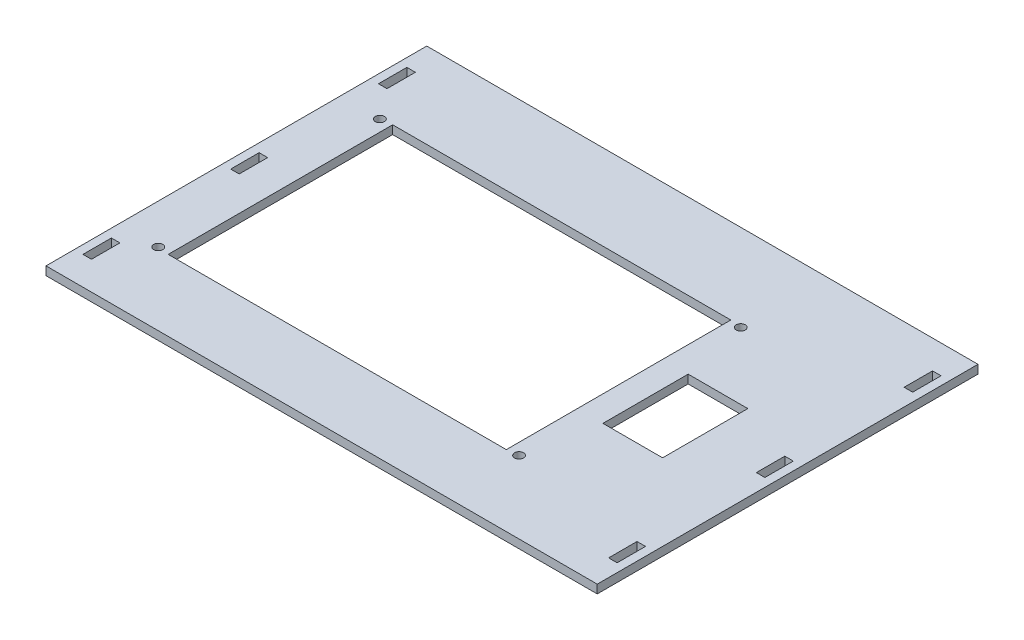
from build123d import *

# Parameters (mm, degrees)
SKETCH1_R           = 1.6
SKETCH1_W           = 119
SKETCH1_H           = 79
SKETCH1_W_2         = 21
SKETCH1_H_2         = 30
SKETCH1_W_3         = 3
SKETCH1_H_3         = 10
BOSS_EXTRUDE1_DEPTH = 3


with BuildPart() as part:
    # Sketch1 → Boss-Extrude1 (new body)
    with BuildSketch(Plane(origin=(0, 0, 0), x_dir=(1, 0, 0), z_dir=(0, 1, 0))):
        Polygon((0, 0), (194, 0), (194, 14.55), (194, 114.55), (194, 134), (0, 134), align=None)
        with Locations(Location((14, 103.5, 0), (0, 0, 270))):
            Circle(SKETCH1_R, mode=Mode.SUBTRACT)
        with Locations(Location((141, 103.5, 0), (0, 0, 270))):
            Circle(SKETCH1_R, mode=Mode.SUBTRACT)
        with Locations(Location((141, 25.5, 0), (0, 0, 270))):
            Circle(SKETCH1_R, mode=Mode.SUBTRACT)
        with Locations(Location((14, 25.5, 0), (0, 0, 270))):
            Circle(SKETCH1_R, mode=Mode.SUBTRACT)
        with Locations((77.5, 64.5)):
            Rectangle(SKETCH1_W, SKETCH1_H, mode=Mode.SUBTRACT)
        with Locations((156.5, 65)):
            Rectangle(SKETCH1_W_2, SKETCH1_H_2, mode=Mode.SUBTRACT)
        with Locations((4.5, 119)):
            Rectangle(SKETCH1_W_3, SKETCH1_H_3, mode=Mode.SUBTRACT)
        with Locations((4.5, 67)):
            Rectangle(SKETCH1_W_3, SKETCH1_H_3, mode=Mode.SUBTRACT)
        with Locations((4.5, 15)):
            Rectangle(SKETCH1_W_3, SKETCH1_H_3, mode=Mode.SUBTRACT)
        with Locations((189.5, 119)):
            Rectangle(SKETCH1_W_3, SKETCH1_H_3, mode=Mode.SUBTRACT)
        with Locations((189.5, 67)):
            Rectangle(SKETCH1_W_3, SKETCH1_H_3, mode=Mode.SUBTRACT)
        with Locations((189.5, 15)):
            Rectangle(SKETCH1_W_3, SKETCH1_H_3, mode=Mode.SUBTRACT)
    extrude(amount=BOSS_EXTRUDE1_DEPTH)


solid = part.part
